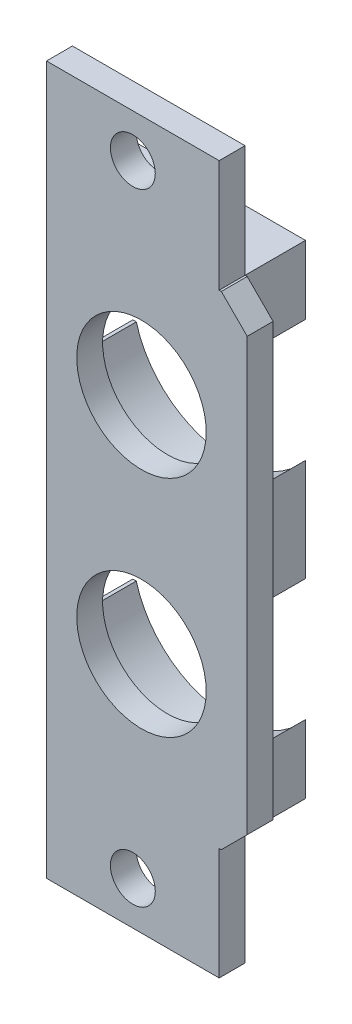
from build123d import *

# Parameters (mm, degrees)
SKETCH10_R           = 7.5
SKETCH10_W           = 20
SKETCH10_H           = 10
SKETCH10_R_2         = 2.6
BOSS_EXTRUDE7_DEPTH  = 3
BOSS_EXTRUDE10_DEPTH = 10
SKETCH12_W           = 3.25
SKETCH12_H           = 56
BOSS_EXTRUDE11_DEPTH = 3
CHAMFER2_SIZE        = 3
CHAMFER3_SIZE        = 3


with BuildPart() as part:
    # Sketch10 → Boss-Extrude7 (new body)
    # profile 1 of 3: a face of its own
    with BuildSketch(Plane.XY):
        Polygon((10, 19.32455532), (10, 31), (-10, 31), (-10, 15.101198027), (-10, -10.060612309), (-10, -31), (10, -31), (10, -17.409211947), align=None)
        with Locations((1, -13)):
            Circle(SKETCH10_R, mode=Mode.SUBTRACT)
        with Locations((1, 13)):
            Circle(SKETCH10_R, mode=Mode.SUBTRACT)
    # profile 2 of 3: a face of its own
    with BuildSketch(Plane.XY):
        with Locations((0, 36)):
            Rectangle(SKETCH10_W, SKETCH10_H)
        with Locations((0, 36)):
            Circle(SKETCH10_R_2, mode=Mode.SUBTRACT)
    # profile 3 of 3: a face of its own
    with BuildSketch(Plane.XY):
        with Locations((0, -36)):
            Rectangle(SKETCH10_W, SKETCH10_H)
        with Locations((0, -36)):
            Circle(SKETCH10_R_2, mode=Mode.SUBTRACT)
    extrude(amount=-BOSS_EXTRUDE7_DEPTH)

    # Sketch9 → Boss-Extrude10 (add)
    with BuildSketch(Plane.XY):
        with BuildLine():
            ThreePointArc((-9.6, 10.026786251), (-1.052303624, 1.988101979), (10, 5.928932188))
            Line((10, 5.928932188), (10, -5.928932188))
            ThreePointArc((10, -5.928932188), (-1.052303624, -1.988101979), (-9.6, -10.026786251))
            Line((-9.6, -10.026786251), (-10, -10.026786251))
            Line((-10, -10.026786251), (-10, 10.026786251))
            Line((-10, 10.026786251), (-9.6, 10.026786251))
        make_face()
        with BuildLine():
            Line((10, 20.071067812), (10, 28))
            Line((10, 28), (-10, 28))
            Line((-10, 28), (-10, 15.973213749))
            Line((-10, 15.973213749), (-9.6, 15.973213749))
            ThreePointArc((-9.6, 15.973213749), (-1.052303624, 24.011898021), (10, 20.071067812))
        make_face()
        with BuildLine():
            Line((-10, -28), (10, -28))
            Line((10, -28), (10, -20.071067812))
            ThreePointArc((10, -20.071067812), (-1.052303624, -24.011898021), (-9.6, -15.973213749))
            Line((-9.6, -15.973213749), (-10, -15.973213749))
            Line((-10, -15.973213749), (-10, -28))
        make_face()
    extrude(amount=-BOSS_EXTRUDE10_DEPTH)

    # Sketch12 → Boss-Extrude11 (add)
    with BuildSketch(Plane(origin=(0, 0, -3), x_dir=(-1, 0, 0), z_dir=(0, 0, -1))):
        with Locations((-11.625, 0)):
            Rectangle(SKETCH12_W, SKETCH12_H)
    extrude(amount=-BOSS_EXTRUDE11_DEPTH)

    # Chamfer2
    chamfer2_edges = [part.edges().sort_by_distance(p)[0] for p in [
        (13.25, -28, -1.5),
    ]]
    chamfer(chamfer2_edges, length=CHAMFER2_SIZE)

    # Chamfer3
    chamfer3_edges = [part.edges().sort_by_distance(p)[0] for p in [
        (13.25, 28, -1.5),
    ]]
    chamfer(chamfer3_edges, length=CHAMFER3_SIZE)


solid = part.part
